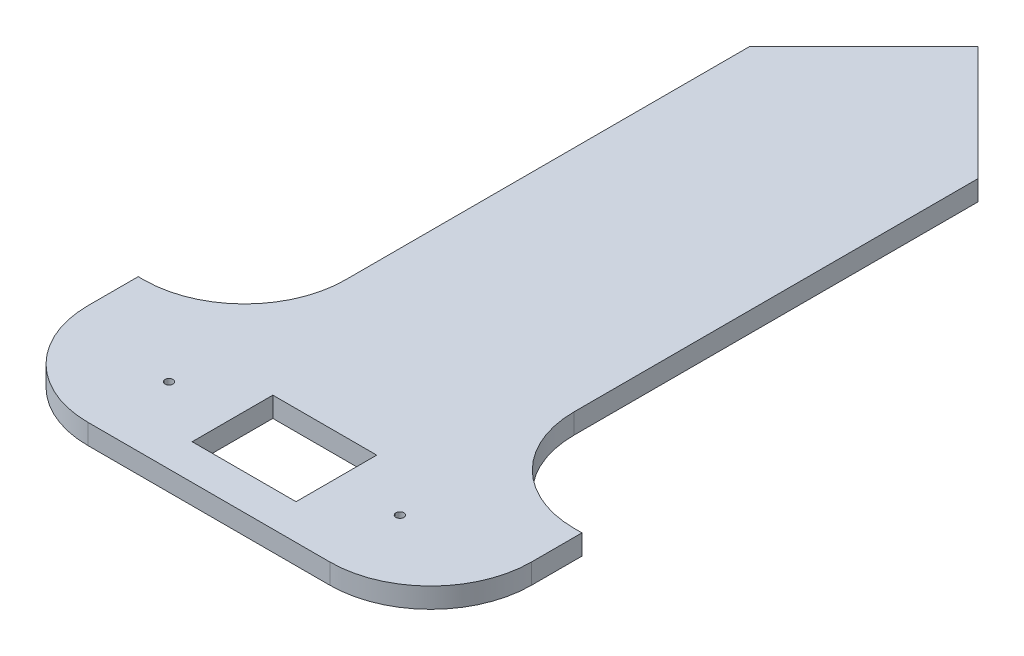
from build123d import *

# Parameters (mm, degrees)
SKETCH2_W               = 44
SKETCH2_H               = 15
BOSS_EXTRUDE1_DEPTH     = 2
SKETCH3_W               = 10.3
SKETCH3_H               = 8
CUT_EXTRUDE1_DEPTH      = 2
SKETCH5_R               = 0.4
CUT_EXTRUDE2_DEPTH      = 2
SKETCH6_W               = 22.666596939
SKETCH6_H               = 61.385041888
BOSS_EXTRUDE3_DEPTH     = 2
FILLET1_R               = 10
CUT_EXTRUDE3_DEPTH      = 73.340507297
CUT_EXTRUDE3_DEPTH_BACK = 2
CUT_EXTRUDE4_DEPTH      = 73.340507297
CUT_EXTRUDE4_DEPTH_BACK = 2
FILLET2_R               = 10


with BuildPart() as part:
    # Sketch2 → Boss-Extrude1 (new body)
    with BuildSketch(Plane(origin=(0, 0, 0), x_dir=(1, 0, 0), z_dir=(0, 1, 0))):
        Rectangle(SKETCH2_W, SKETCH2_H)
    extrude(amount=BOSS_EXTRUDE1_DEPTH)

    # Sketch3 → Cut-Extrude1 (cut)
    with BuildSketch(Plane(origin=(0, 2, 0), x_dir=(1, 0, 0), z_dir=(0, 1, 0))):
        Rectangle(SKETCH3_W, SKETCH3_H)
    extrude(amount=-CUT_EXTRUDE1_DEPTH, mode=Mode.SUBTRACT)

    # Sketch5 → Cut-Extrude2 (cut)
    with BuildSketch(Plane(origin=(0, 2, 0), x_dir=(1, 0, 0), z_dir=(0, 1, 0))):
        with Locations(Location((-11.45, 0, 0), (0, 0, 270))):
            Circle(SKETCH5_R)
    cut_extrude2 = extrude(amount=-CUT_EXTRUDE2_DEPTH, mode=Mode.SUBTRACT)

    # Mirror1: Cut-Extrude2 across plane
    add(cut_extrude2.mirror(Plane(origin=(0, 0, 0), x_dir=(0, 0, 1), z_dir=(1, 0, 0))), mode=Mode.SUBTRACT)

    # Sketch6 → Boss-Extrude3 (add)
    with BuildSketch(Plane(origin=(0, 2, 0), x_dir=(1, 0, 0), z_dir=(0, 1, 0))):
        with Locations((-0.116701531, 38.192520944)):
            Rectangle(SKETCH6_W, SKETCH6_H)
    extrude(amount=-BOSS_EXTRUDE3_DEPTH)

    # Fillet1
    fillet1_edges = [part.edges().sort_by_distance(p)[0] for p in [
        (-11.45, 1, -7.5),
        (11.216596939, 1, -7.5),
    ]]
    fillet(fillet1_edges, radius=FILLET1_R)

    # Sketch8 → Cut-Extrude3 (cut, two sides: drawn at the far end of the back side and taken through both)
    with BuildSketch(Plane(origin=(0, 2, 0), x_dir=(1, 0, 0), z_dir=(0, 1, 0)).offset(-CUT_EXTRUDE3_DEPTH_BACK)):
        Polygon((119.416120766, 188.417864185), (-0.11670153, 68.885041888), (-11.45, 57.551743419), (-130.982822296, -61.981078878), (-370.048466889, 177.084565715), (-119.649523827, 427.483508777), align=None)
    extrude(amount=CUT_EXTRUDE3_DEPTH + CUT_EXTRUDE3_DEPTH_BACK, mode=Mode.SUBTRACT)

    # Sketch9 → Cut-Extrude4 (cut, two sides: drawn at the far end of the back side and taken through both)
    with BuildSketch(Plane(origin=(0, 2, 0), x_dir=(1, 0, 0), z_dir=(0, 1, 0)).offset(-CUT_EXTRUDE4_DEPTH_BACK)):
        Polygon((-119.649523827, 188.417864185), (-0.11670153, 68.885041888), (11.216596939, 57.551743419), (130.749419236, -61.981078878), (369.815063828, 177.084565715), (119.416120766, 427.483508777), align=None)
    extrude(amount=CUT_EXTRUDE4_DEPTH + CUT_EXTRUDE4_DEPTH_BACK, mode=Mode.SUBTRACT)

    # Fillet2
    fillet2_edges = [part.edges().sort_by_distance(p)[0] for p in [
        (22, 1, 7.5),
        (-22, 1, 7.5),
    ]]
    fillet(fillet2_edges, radius=FILLET2_R)


solid = part.part
